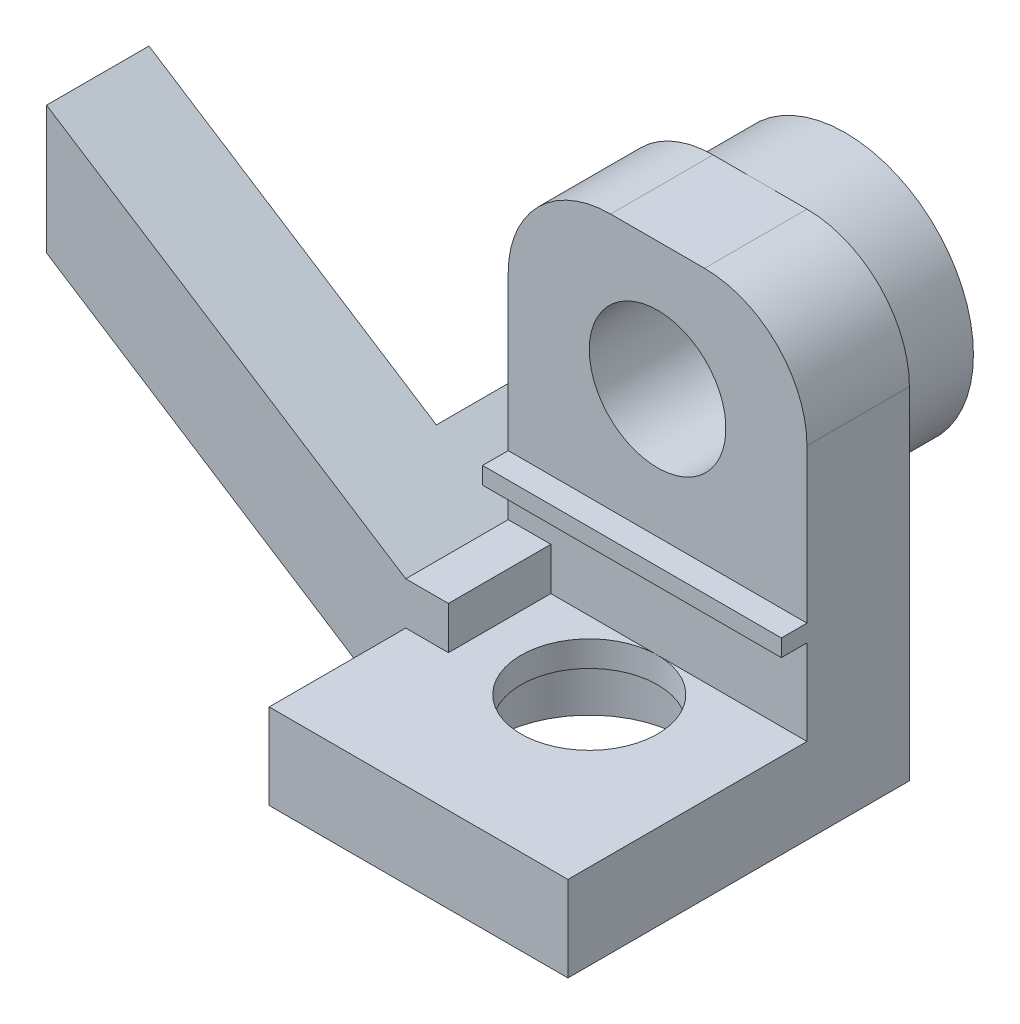
from build123d import *

# Parameters (mm, degrees)
SKETCH1_W           = 35
SKETCH1_H           = 12
BOSS_EXTRUDE1_DEPTH = 20
SKETCH2_W           = 35
SKETCH2_H           = 12
BOSS_EXTRUDE2_DEPTH = 10
CUT_EXTRUDE1_DEPTH  = 12
FILLET1_R           = 12
SKETCH5_R           = 15
SKETCH5_R_2         = 12
BOSS_EXTRUDE3_DEPTH = 10
SKETCH6_W           = 35
SKETCH6_H           = 15
BOSS_EXTRUDE4_DEPTH = 2
SKETCH7_W           = 35
SKETCH7_H           = 12
BOSS_EXTRUDE5_DEPTH = 10
SKETCH8_W           = 35
SKETCH8_H           = 40
BOSS_EXTRUDE6_DEPTH = 10
SKETCH10_R          = 11.2
CUT_EXTRUDE2_DEPTH  = 7
SKETCH11_R          = 8
CUT_EXTRUDE3_DEPTH  = 3
BOSS_EXTRUDE7_DEPTH = 12
BOSS_EXTRUDE8_DEPTH = 12
SKETCH14_W          = 12
SKETCH14_H          = 5
BOSS_EXTRUDE9_DEPTH = 5


with BuildPart() as part:
    # Sketch1 → Boss-Extrude1 (new body)
    with BuildSketch(Plane(origin=(0, 0, 0), x_dir=(1, 0, 0), z_dir=(0, 1, 0))):
        Rectangle(SKETCH1_W, SKETCH1_H)
    extrude(amount=BOSS_EXTRUDE1_DEPTH)

    # Sketch2 → Boss-Extrude2 (add)
    with BuildSketch(Plane(origin=(0, 20, 0), x_dir=(1, 0, 0), z_dir=(0, 1, 0))):
        Rectangle(SKETCH2_W, SKETCH2_H)
    extrude(amount=BOSS_EXTRUDE2_DEPTH)

    # Sketch4 → Cut-Extrude1 (cut)
    with BuildSketch(Plane(origin=(0, 0, -6), x_dir=(-1, 0, 0), z_dir=(0, 0, -1))):
        with BuildLine():
            ThreePointArc((8, 15), (0, 23), (-8, 15))
            Line((-8, 15), (8, 15))
        make_face()
        with BuildLine():
            Line((8, 15), (-8, 15))
            ThreePointArc((-8, 15), (0, 7), (8, 15))
        make_face()
    extrude(amount=-CUT_EXTRUDE1_DEPTH, mode=Mode.SUBTRACT)

    # Fillet1
    fillet1_edges = [part.edges().sort_by_distance(p)[0] for p in [
        (-17.5, 30, 0),
        (17.5, 30, 0),
    ]]
    fillet(fillet1_edges, radius=FILLET1_R)

    # Sketch5 → Boss-Extrude3 (add)
    with BuildSketch(Plane(origin=(0, 0, -6), x_dir=(-1, 0, 0), z_dir=(0, 0, -1))):
        with Locations(Location((0, 15, 0), (0, 0, 270))):
            Circle(SKETCH5_R)
        with Locations((0, 15)):
            Circle(SKETCH5_R_2, mode=Mode.SUBTRACT)
    extrude(amount=BOSS_EXTRUDE3_DEPTH)

    # Sketch6 → Boss-Extrude4 (add)
    with BuildSketch(Plane.XZ):
        with Locations((0, 1.5)):
            Rectangle(SKETCH6_W, SKETCH6_H)
    extrude(amount=BOSS_EXTRUDE4_DEPTH)

    # Sketch7 → Boss-Extrude5 (add)
    with BuildSketch(Plane.XZ.offset(2)):
        Rectangle(SKETCH7_W, SKETCH7_H)
    extrude(amount=BOSS_EXTRUDE5_DEPTH)

    # Sketch8 → Boss-Extrude6 (add)
    with BuildSketch(Plane.XZ.offset(12)):
        with Locations((0, 14)):
            Rectangle(SKETCH8_W, SKETCH8_H)
    extrude(amount=BOSS_EXTRUDE6_DEPTH)

    # Sketch10 → Cut-Extrude2 (cut)
    with BuildSketch(Plane.XZ.offset(22)):
        with Locations(Location((0, 14, 0), (0, 0, 270))):
            Circle(SKETCH10_R)
    extrude(amount=-CUT_EXTRUDE2_DEPTH, mode=Mode.SUBTRACT)

    # Sketch11 → Cut-Extrude3 (cut)
    with BuildSketch(Plane.XZ.offset(15)):
        with Locations(Location((0, 14, 0), (0, 0, 270))):
            Circle(SKETCH11_R)
    extrude(amount=-CUT_EXTRUDE3_DEPTH, mode=Mode.SUBTRACT)

    # Sketch12 → Boss-Extrude7 (add)
    with BuildSketch(Plane(origin=(0, 0, -6), x_dir=(-1, 0, 0), z_dir=(0, 0, -1))):
        Polygon((17.5, -22), (17.5, -7), (25.915107819, -1.597596795), (25.915107819, -16.597596795), align=None)
    extrude(amount=-BOSS_EXTRUDE7_DEPTH)

    # Sketch13 → Boss-Extrude8 (add)
    with BuildSketch(Plane.XY.offset(6)):
        Polygon((-17.5, -22), (-17.5, -7), (-59.575539097, 20.012016024), (-59.575539097, 5.012016024), align=None)
    extrude(amount=BOSS_EXTRUDE8_DEPTH)

    # Sketch14 → Boss-Extrude9 (add)
    with BuildSketch(Plane(origin=(-17.5, 0, 0), x_dir=(0, 0, -1), z_dir=(1, 0, 0))):
        with Locations((-12, -9.5)):
            Rectangle(SKETCH14_W, SKETCH14_H)
    extrude(amount=BOSS_EXTRUDE9_DEPTH)


solid = part.part
